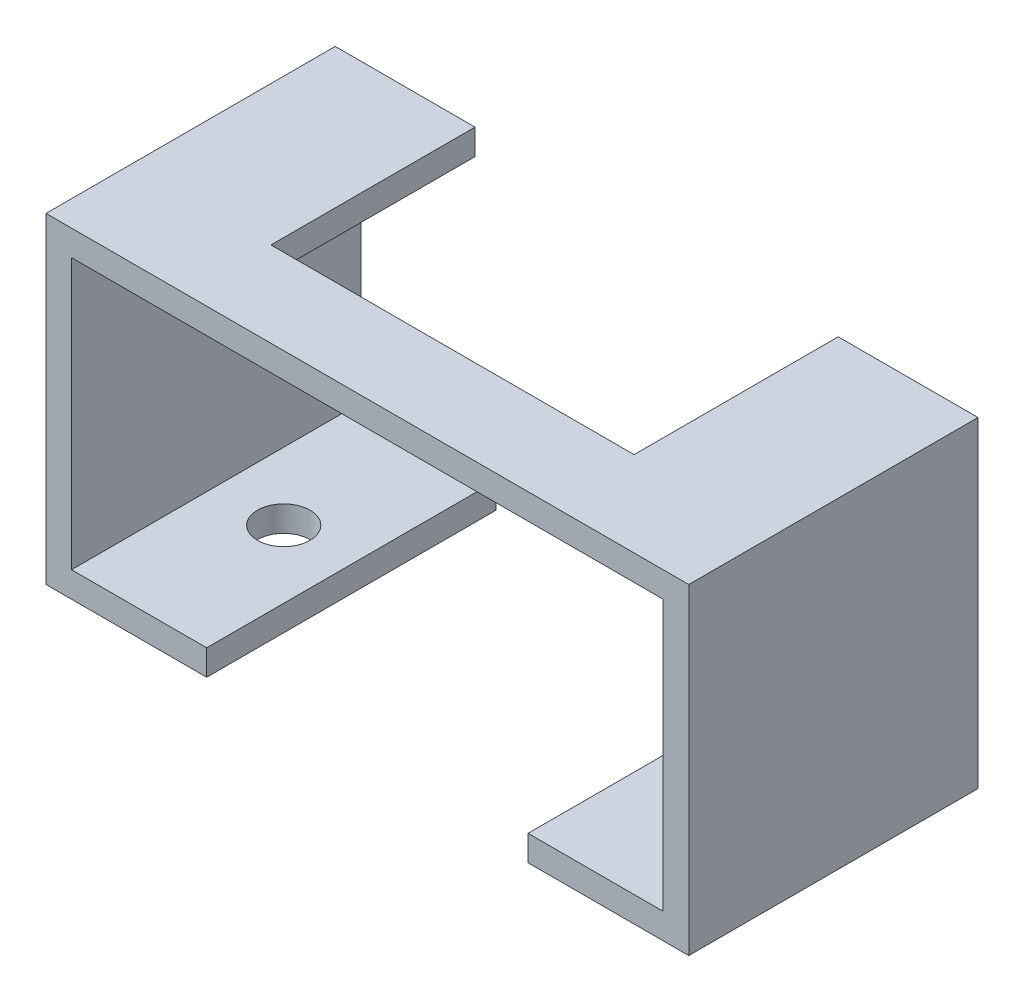
from build123d import *

# Parameters (mm, degrees)
BOSS_EXTRUDE1_DEPTH       = 18
SKETCH2_W                 = 22.6
SKETCH2_H                 = 12.7
CUT_EXTRUDE1_DEPTH        = 10
F_4_CLEARANCE_HOLE3_D     = 3.2639
F_4_CLEARANCE_HOLE3_DEPTH = 1.59


with BuildPart() as part:
    # Sketch1 → Boss-Extrude1 (new body)
    with BuildSketch(Plane.XY):
        Polygon((10, -20), (0, -20), (0, 0), (40, 0), (40, -20), (30, -20), (30, -18.41), (38.41, -18.41), (38.41, -1.59), (1.59, -1.59), (1.59, -18.41), (10, -18.41), align=None)
    extrude(amount=BOSS_EXTRUDE1_DEPTH)

    # Sketch2 → Cut-Extrude1 (cut)
    with BuildSketch(Plane(origin=(0, 0, 0), x_dir=(1, 0, 0), z_dir=(0, 1, 0))):
        with Locations((20, -6.35)):
            Rectangle(SKETCH2_W, SKETCH2_H)
    extrude(amount=-CUT_EXTRUDE1_DEPTH, mode=Mode.SUBTRACT)

    # #4 Clearance Hole3
    with Locations(Plane(origin=(0, -18.41, 0), x_dir=(1, 0, 0), z_dir=(0, 1, 0))):
        with Locations((5.795, -9), (34.205, -9)):
            Hole(F_4_CLEARANCE_HOLE3_D / 2, depth=F_4_CLEARANCE_HOLE3_DEPTH)


solid = part.part
